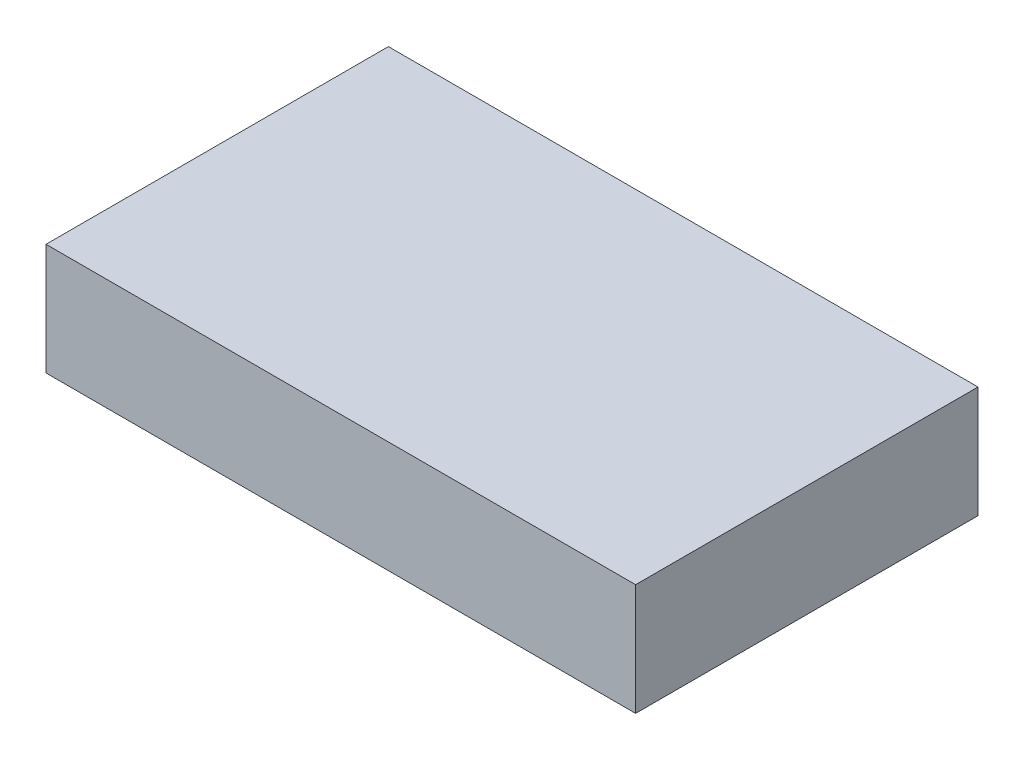
from build123d import *

# Parameters (mm, degrees)
SKETCH2_W           = 22.214358562
SKETCH2_H           = 4.2
BOSS_EXTRUDE1_DEPTH = 12.9


with BuildPart() as part:
    # Sketch2 → Boss-Extrude1 (new body)
    with BuildSketch(Plane.XY):
        Rectangle(SKETCH2_W, SKETCH2_H)
    extrude(amount=BOSS_EXTRUDE1_DEPTH)


solid = part.part
